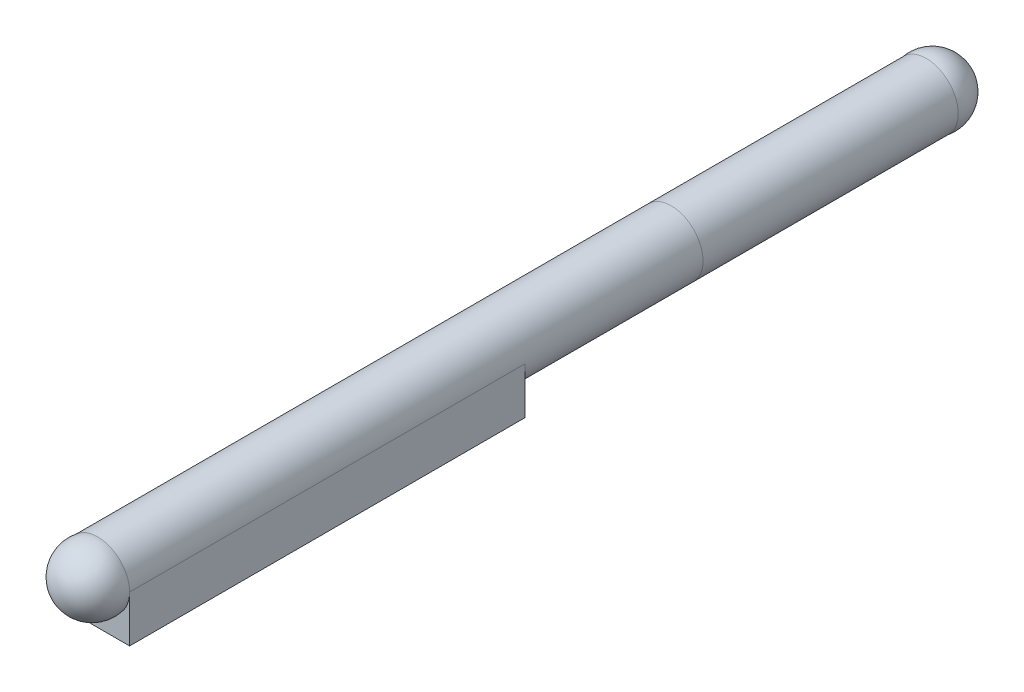
from build123d import *

# Parameters (mm, degrees)
EXTRUDE1_DEPTH      = 44.94
EXTRUDE1_DEPTH_BACK = 20
SKETCH1_R           = 2.5
DOME1_FACE_RADIUS   = 2.5
DOME1_HEIGHT        = 3
DOME2_FACE_RADIUS   = 2.5
DOME2_HEIGHT        = 3
EXTRUDE2_REACH      = 50.406
EXTRUDE2_END_RADIUS = 2.5
SKETCH2_W           = 5
SKETCH2_H           = 31


with BuildPart() as part:
    # Sketch1 → Extrude1 (new, two sides: drawn at the far end of the back side and taken through both)
    with BuildSketch(Plane.XY.offset(-EXTRUDE1_DEPTH_BACK)):
        with Locations((0, 4)):
            Circle(SKETCH1_R)
    extrude(amount=EXTRUDE1_DEPTH + EXTRUDE1_DEPTH_BACK)

    # Dome1: a dome of height H over a round flat face of radius A is a cap of a sphere of radius (A * A + H * H) / (2 * H)
    dome1_r = (DOME1_FACE_RADIUS * DOME1_FACE_RADIUS + DOME1_HEIGHT * DOME1_HEIGHT) / (2 * DOME1_HEIGHT)
    dome1_base = Plane((0, 4, 44.94), z_dir=(0, 0, 1))
    with Locations(dome1_base.offset(DOME1_HEIGHT - dome1_r)):
        dome1_ball = Sphere(dome1_r, mode=Mode.PRIVATE)
    add(split(dome1_ball, bisect_by=dome1_base, keep=Keep.TOP, mode=Mode.PRIVATE))

    # Dome2: a dome of height H over a round flat face of radius A is a cap of a sphere of radius (A * A + H * H) / (2 * H)
    dome2_r = (DOME2_FACE_RADIUS * DOME2_FACE_RADIUS + DOME2_HEIGHT * DOME2_HEIGHT) / (2 * DOME2_HEIGHT)
    dome2_base = Plane((0, 4, -20), z_dir=(0, 0, -1))
    with Locations(dome2_base.offset(DOME2_HEIGHT - dome2_r)):
        dome2_ball = Sphere(dome2_r, mode=Mode.PRIVATE)
    add(split(dome2_ball, bisect_by=dome2_base, keep=Keep.TOP, mode=Mode.PRIVATE))

    # Extrude2: up to this cylinder (the profile starts outside it)
    extrude2_end = Plane(origin=(0, 4, 29.44), z_dir=(0, 0, 1)) * Cylinder(EXTRUDE2_END_RADIUS, 106.812, mode=Mode.PRIVATE)
    # Sketch2 → Extrude2 (add, up to the surface)
    with BuildSketch(Plane(origin=(0, 0.34, 0), x_dir=(-1, 0, 0), z_dir=(0, 1, 0)), mode=Mode.PRIVATE) as extrude2_sk1:
        with Locations((0, 29.44)):
            Rectangle(SKETCH2_W, SKETCH2_H)
    extrude2_tool1 = extrude(extrude2_sk1.sketch, amount=EXTRUDE2_REACH, mode=Mode.PRIVATE) - extrude2_end
    add(extrude2_tool1.solids().sort_by_distance((0, 0.34, 29.44))[0])


solid = part.part
